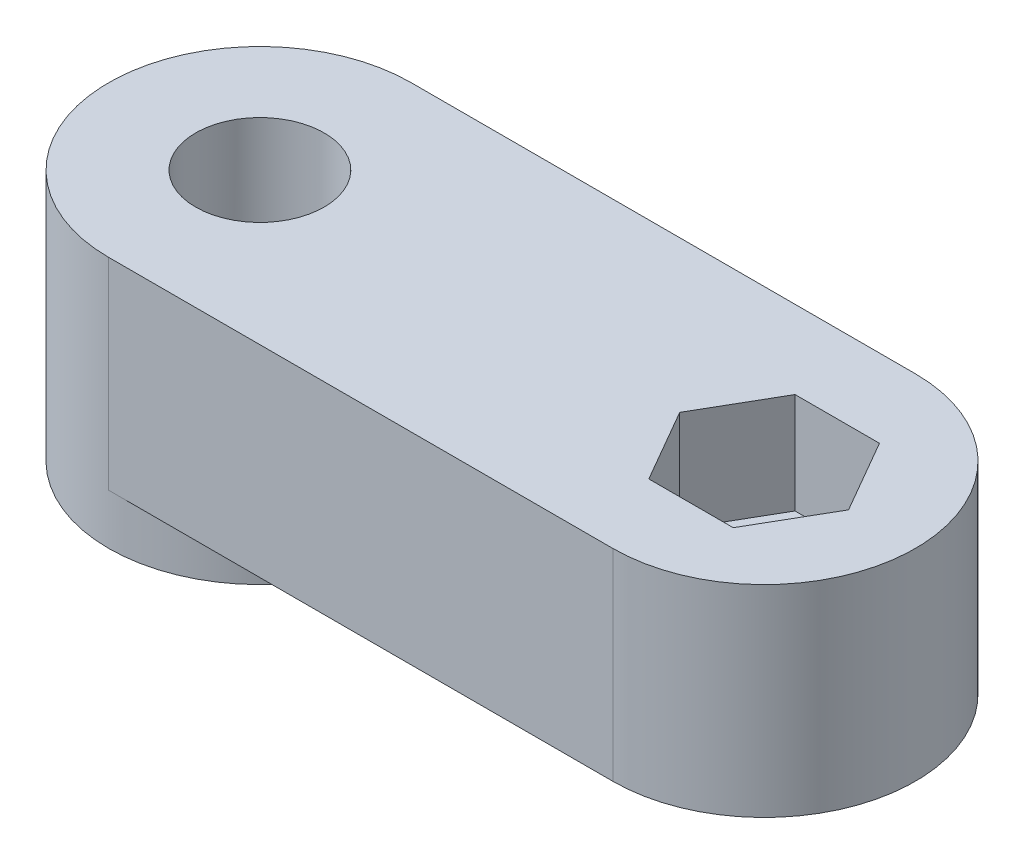
from build123d import *

# Parameters (mm, degrees)
EXTRUDE_1_DEPTH     = 10
CUT_EXTRUDE_1_DEPTH = 5
SKETCH_6_R          = 27.317981471
SKETCH_6_R_2        = 6
CUT_EXTRUDE_2_DEPTH = 2
CUT_EXTRUDE_3_DEPTH = 4


with BuildPart() as part:
    # 草图1 → 凸台-拉伸1 (new body)
    with BuildSketch(Plane(origin=(0, 0, 0), x_dir=(1, 0, 0), z_dir=(0, 1, 0))):
        with BuildLine():
            Line((0, 6), (20, 6))
            ThreePointArc((20, 6), (26, 0), (20, -6))
            Line((20, -6), (0, -6))
            ThreePointArc((0, -6), (-6, 0), (0, 6))
        make_face()
    extrude(amount=EXTRUDE_1_DEPTH)

    # 草图3 → 切除-旋转2 (revolve, cut)
    with BuildSketch(Plane.XY, mode=Mode.PRIVATE) as cut_revolve_2_sk:
        Polygon((0, 10), (-2.55, 10), (-2.55, 5), (-2.1, 5), (-2.1, 2), (-2.55, 2), (-2.55, 0), (0, 0), align=None)
    revolve(cut_revolve_2_sk.sketch.rotate(Axis((0, 10, 0), (0, -1, 0)), 270), axis=Axis((0, 10, 0), (0, -1, 0)), mode=Mode.SUBTRACT)

    # 草图4 → 切除-旋转3 (revolve, cut)
    with BuildSketch(Plane.XY, mode=Mode.PRIVATE) as cut_revolve_3_sk:
        Polygon((20, 10), (17.5, 10), (17.5, 5), (17.925, 5), (17.925, 0), (20, 0), align=None)
    revolve(cut_revolve_3_sk.sketch.rotate(Axis((20, 10, 0), (0, -1, 0)), 270), axis=Axis((20, 10, 0), (0, -1, 0)), mode=Mode.SUBTRACT)

    # 草图5 → 切除-拉伸1 (cut)
    with BuildSketch(Plane.XZ):
        Polygon((-4.214656965, 0), (-2.107328483, -3.65), (2.107328483, -3.65), (4.214656965, 0), (2.107328483, 3.65), (-2.107328483, 3.65), align=None)
    extrude(amount=-CUT_EXTRUDE_1_DEPTH, mode=Mode.SUBTRACT)

    # 草图6 → 切除-拉伸2 (cut)
    with BuildSketch(Plane.XZ):
        Circle(SKETCH_6_R)
        with Locations(Location((0, 0, 0), (0, 0, 90))):
            Circle(SKETCH_6_R_2, mode=Mode.SUBTRACT)
    extrude(amount=-CUT_EXTRUDE_2_DEPTH, mode=Mode.SUBTRACT)

    # 草图7 → 切除-拉伸3 (cut)
    with BuildSketch(Plane(origin=(0, 10, 0), x_dir=(1, 0, 0), z_dir=(0, 1, 0))):
        Polygon((18.325684219, 2.9), (16.651368439, 0), (18.325684219, -2.9), (21.674315781, -2.9), (23.348631561, 0), (21.674315781, 2.9), align=None)
    extrude(amount=-CUT_EXTRUDE_3_DEPTH, mode=Mode.SUBTRACT)


solid = part.part
